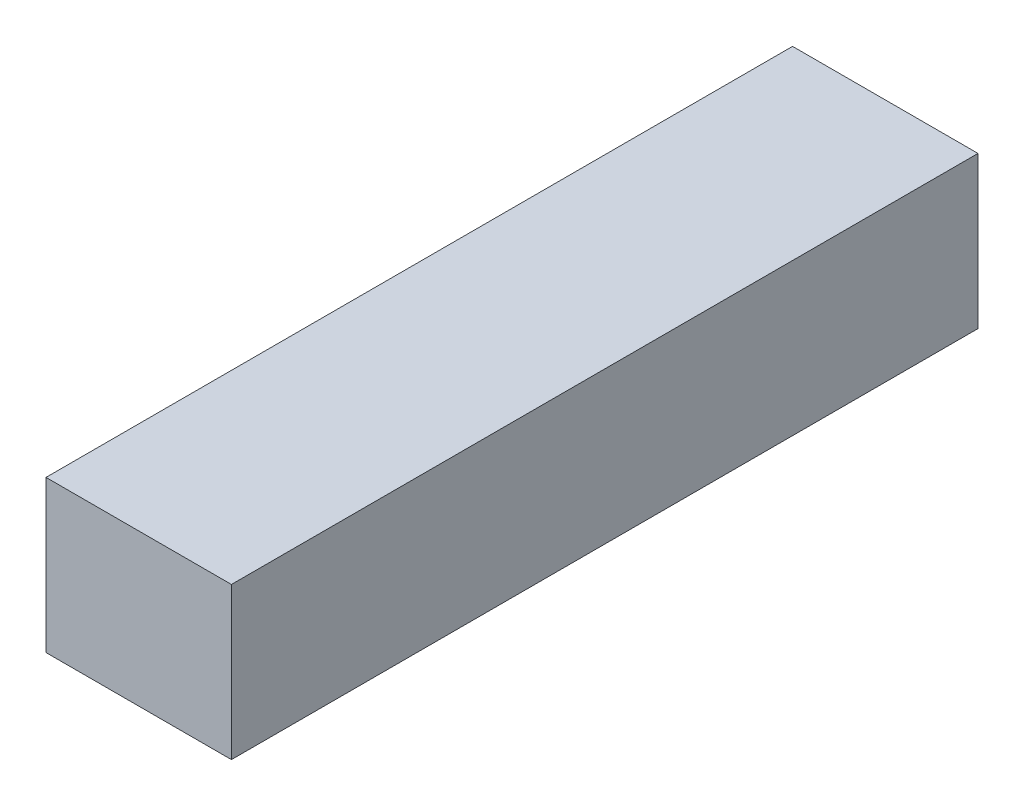
from build123d import *

# Parameters (mm, degrees)
SKETCH1_W           = 15.4
SKETCH1_H           = 12.6
BOSS_EXTRUDE1_DEPTH = 31


with BuildPart() as part:
    # Sketch1 → Boss-Extrude1 (new, symmetric)
    with BuildSketch(Plane.XY):
        Rectangle(SKETCH1_W, SKETCH1_H)
    extrude(amount=BOSS_EXTRUDE1_DEPTH, both=True)


solid = part.part
